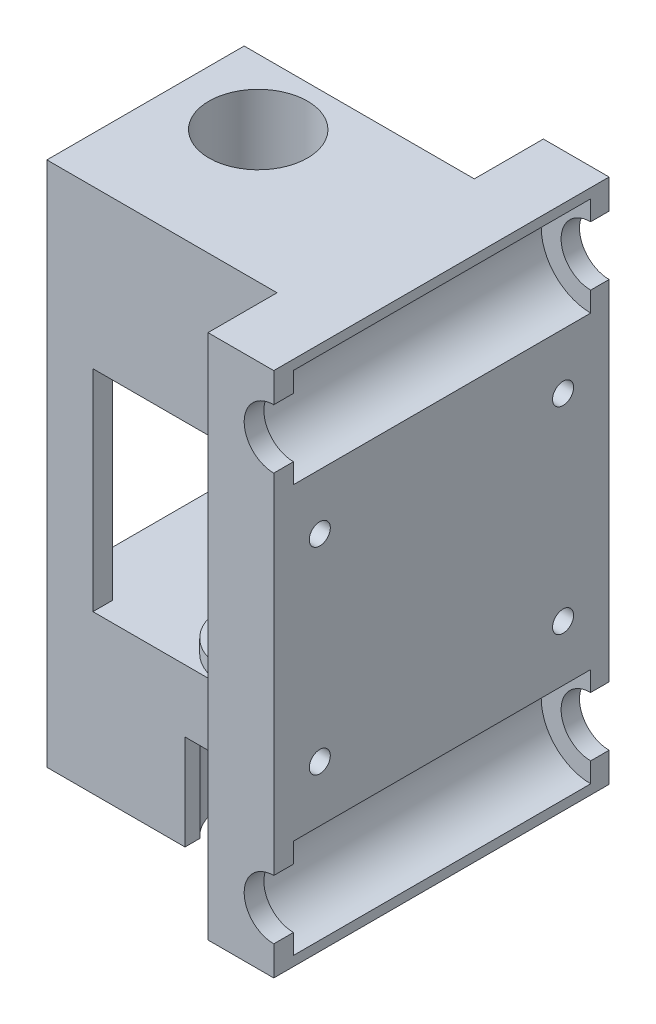
from build123d import *

# Parameters (mm, degrees)
SKETCH1_W           = 10
SKETCH1_H           = 80
BOSS_EXTRUDE1_DEPTH = 51
SKETCH2_R           = 7.525
CUT_EXTRUDE1_DEPTH  = 45.2
SKETCH3_R           = 4.5
CUT_EXTRUDE2_DEPTH  = 96.399161422
SKETCH4_W           = 30
SKETCH4_H           = 80
BOSS_EXTRUDE2_DEPTH = 35
SKETCH6_R           = 4.015
CUT_EXTRUDE3_DEPTH  = 5
SKETCH7_W           = 24
SKETCH7_H           = 32
CUT_EXTRUDE4_DEPTH  = 35
SKETCH8_W           = 28
SKETCH8_H           = 32
CUT_EXTRUDE5_DEPTH  = 101.325719534
CUT_EXTRUDE9_DEPTH  = 3
SKETCH15_R          = 1.6
CUT_EXTRUDE10_DEPTH = 103.200782776
SKETCH16_R          = 4
CUT_EXTRUDE11_DEPTH = 106.004761797
SKETCH19_R          = 4
CUT_EXTRUDE13_DEPTH = 106.004761797
BOSS_EXTRUDE3_START = 5.45
SKETCH20_R          = 7.5
SKETCH20_R_2        = 4
BOSS_EXTRUDE3_DEPTH = 5.45
BOSS_EXTRUDE4_START = 2.1
SKETCH21_R          = 7.5
SKETCH21_R_2        = 4
BOSS_EXTRUDE4_DEPTH = 2.1
BOSS_EXTRUDE5_START = -24
SKETCH22_R          = 4
BOSS_EXTRUDE5_DEPTH = 24
BOSS_EXTRUDE6_START = -24
SKETCH23_R          = 4
BOSS_EXTRUDE6_DEPTH = 24
CUT_EXTRUDE14_START = -17.8
SKETCH24_R          = 7.5
CUT_EXTRUDE14_DEPTH = 17.8
CUT_EXTRUDE15_START = -14.5
SKETCH25_R          = 7.5
CUT_EXTRUDE15_DEPTH = 14.5
CUT_EXTRUDE16_START = -14.5
CUT_EXTRUDE16_DEPTH = 14.5


with BuildPart() as part:
    # Sketch1 → Boss-Extrude1 (new body)
    with BuildSketch(Plane.XY):
        with Locations((-5, 40)):
            Rectangle(SKETCH1_W, SKETCH1_H)
    extrude(amount=BOSS_EXTRUDE1_DEPTH)

    # Sketch2 → Cut-Extrude1 (cut)
    with BuildSketch(Plane.XY.offset(48)):
        with Locations((0, 71)):
            Circle(SKETCH2_R)
        with Locations((0, 9)):
            Circle(SKETCH2_R)
    extrude(amount=-CUT_EXTRUDE1_DEPTH, mode=Mode.SUBTRACT)

    # Sketch3 → Cut-Extrude2 (cut, through all)
    with BuildSketch(Plane.XY.offset(51)):
        with Locations((0, 71)):
            Circle(SKETCH3_R)
        with Locations((0, 9)):
            Circle(SKETCH3_R)
    extrude(amount=-CUT_EXTRUDE2_DEPTH, mode=Mode.SUBTRACT)

    # Sketch4 → Boss-Extrude2 (add)
    with BuildSketch(Plane.ZY.offset(10)):
        with Locations((25.5, 40)):
            Rectangle(SKETCH4_W, SKETCH4_H)
    extrude(amount=BOSS_EXTRUDE2_DEPTH)

    # Sketch6 → Cut-Extrude3 (cut)
    with BuildSketch(Plane.ZY.offset(45)):
        with Locations((25.5, 71)):
            Circle(SKETCH6_R)
        with Locations((25.5, 9)):
            Circle(SKETCH6_R)
    extrude(amount=-CUT_EXTRUDE3_DEPTH, mode=Mode.SUBTRACT)

    # Sketch7 → Cut-Extrude4 (cut)
    with BuildSketch(Plane.ZY.offset(45)):
        with Locations((25.5, 40)):
            Rectangle(SKETCH7_W, SKETCH7_H)
    extrude(amount=-CUT_EXTRUDE4_DEPTH, mode=Mode.SUBTRACT)

    # Sketch8 → Cut-Extrude5 (cut, through all)
    with BuildSketch(Plane.XY.offset(40.5)):
        with Locations((-24, 40)):
            Rectangle(SKETCH8_W, SKETCH8_H)
    extrude(amount=-CUT_EXTRUDE5_DEPTH, mode=Mode.SUBTRACT)

    # Sketch14 → Cut-Extrude9 (cut)
    with BuildSketch(Plane.ZY.offset(10)):
        Polygon((47.262029021, 55), (45.63101451, 57.825), (42.36898549, 57.825), (40.737970979, 55), (42.36898549, 52.175), (45.63101451, 52.175), align=None)
        Polygon((10.262029021, 55), (8.63101451, 57.825), (5.36898549, 57.825), (3.737970979, 55), (5.36898549, 52.175), (8.63101451, 52.175), align=None)
        Polygon((10.262029021, 25), (8.63101451, 27.825), (5.36898549, 27.825), (3.737970979, 25), (5.36898549, 22.175), (8.63101451, 22.175), align=None)
        Polygon((47.262029021, 25), (45.63101451, 27.825), (42.36898549, 27.825), (40.737970979, 25), (42.36898549, 22.175), (45.63101451, 22.175), align=None)
    extrude(amount=-CUT_EXTRUDE9_DEPTH, mode=Mode.SUBTRACT)

    # Sketch15 → Cut-Extrude10 (cut, through all)
    with BuildSketch(Plane.ZY.offset(7)):
        with Locations((44, 55)):
            Circle(SKETCH15_R)
        with Locations((7, 55)):
            Circle(SKETCH15_R)
        with Locations((7, 25)):
            Circle(SKETCH15_R)
        with Locations((44, 25)):
            Circle(SKETCH15_R)
    extrude(amount=-CUT_EXTRUDE10_DEPTH, mode=Mode.SUBTRACT)

    # Sketch16 → Cut-Extrude11 (cut, through all)
    with BuildSketch(Plane(origin=(0, 80, 0), x_dir=(1, 0, 0), z_dir=(0, 1, 0))):
        with Locations(Location((-19, -32.664, 0), (0, 0, 270))):
            Circle(SKETCH16_R)
    extrude(amount=-CUT_EXTRUDE11_DEPTH, mode=Mode.SUBTRACT)

    # Sketch19 → Cut-Extrude13 (cut, through all)
    with BuildSketch(Plane.XZ):
        with Locations(Location((-32.925, 20.436, 0), (0, 0, 270))):
            Circle(SKETCH19_R)
    extrude(amount=-CUT_EXTRUDE13_DEPTH, mode=Mode.SUBTRACT)

    # Sketch20 → Boss-Extrude3 (add)
    with BuildSketch(Plane.XZ.offset(-56).offset(BOSS_EXTRUDE3_START)):
        with Locations(Location((-32.925, 20.436, 0), (0, 0, 90))):
            Circle(SKETCH20_R)
        with Locations(Location((-32.925, 20.436, 0), (0, 0, 270))):
            Circle(SKETCH20_R_2, mode=Mode.SUBTRACT)
    extrude(amount=-BOSS_EXTRUDE3_DEPTH)

    # Sketch21 → Boss-Extrude4 (add)
    with BuildSketch(Plane(origin=(0, 24, 0), x_dir=(1, 0, 0), z_dir=(0, 1, 0)).offset(BOSS_EXTRUDE4_START)):
        with Locations(Location((-19, -32.664, 0), (0, 0, 90))):
            Circle(SKETCH21_R)
        with Locations(Location((-19, -32.664, 0), (0, 0, 270))):
            Circle(SKETCH21_R_2, mode=Mode.SUBTRACT)
    extrude(amount=-BOSS_EXTRUDE4_DEPTH)

    # Sketch22 → Boss-Extrude5 (add)
    with BuildSketch(Plane.XZ.offset(-56).offset(BOSS_EXTRUDE5_START)):
        with Locations(Location((-19, 32.664, 0), (0, 0, 90))):
            Circle(SKETCH22_R)
    extrude(amount=BOSS_EXTRUDE5_DEPTH)

    # Sketch23 → Boss-Extrude6 (add)
    with BuildSketch(Plane(origin=(0, 24, 0), x_dir=(1, 0, 0), z_dir=(0, 1, 0)).offset(BOSS_EXTRUDE6_START)):
        with Locations(Location((-32.925, -20.436, 0), (0, 0, 90))):
            Circle(SKETCH23_R)
    extrude(amount=BOSS_EXTRUDE6_DEPTH)

    # Sketch24 → Cut-Extrude14 (cut)
    with BuildSketch(Plane(origin=(0, 80, 0), x_dir=(1, 0, 0), z_dir=(0, 1, 0)).offset(CUT_EXTRUDE14_START)):
        with Locations(Location((-32.925, -20.436, 0), (0, 0, 270))):
            Circle(SKETCH24_R)
    extrude(amount=CUT_EXTRUDE14_DEPTH, mode=Mode.SUBTRACT)

    # Sketch25 → Cut-Extrude15 (cut)
    with BuildSketch(Plane.XZ.offset(CUT_EXTRUDE15_START)):
        with Locations(Location((-19, 32.664, 0), (0, 0, 270))):
            Circle(SKETCH25_R)
    extrude(amount=CUT_EXTRUDE15_DEPTH, mode=Mode.SUBTRACT)

    # Sketch26 → Cut-Extrude16 (cut)
    with BuildSketch(Plane.XZ.offset(CUT_EXTRUDE16_START)):
        with BuildLine():
            Line((-14, 40.5), (-14, 38.254169944))
            ThreePointArc((-14, 38.254169944), (-19, 40.164), (-24, 38.254169944))
            Line((-24, 38.254169944), (-24, 40.5))
            Line((-24, 40.5), (-14, 40.5))
        make_face()
    extrude(amount=CUT_EXTRUDE16_DEPTH, mode=Mode.SUBTRACT)


solid = part.part
